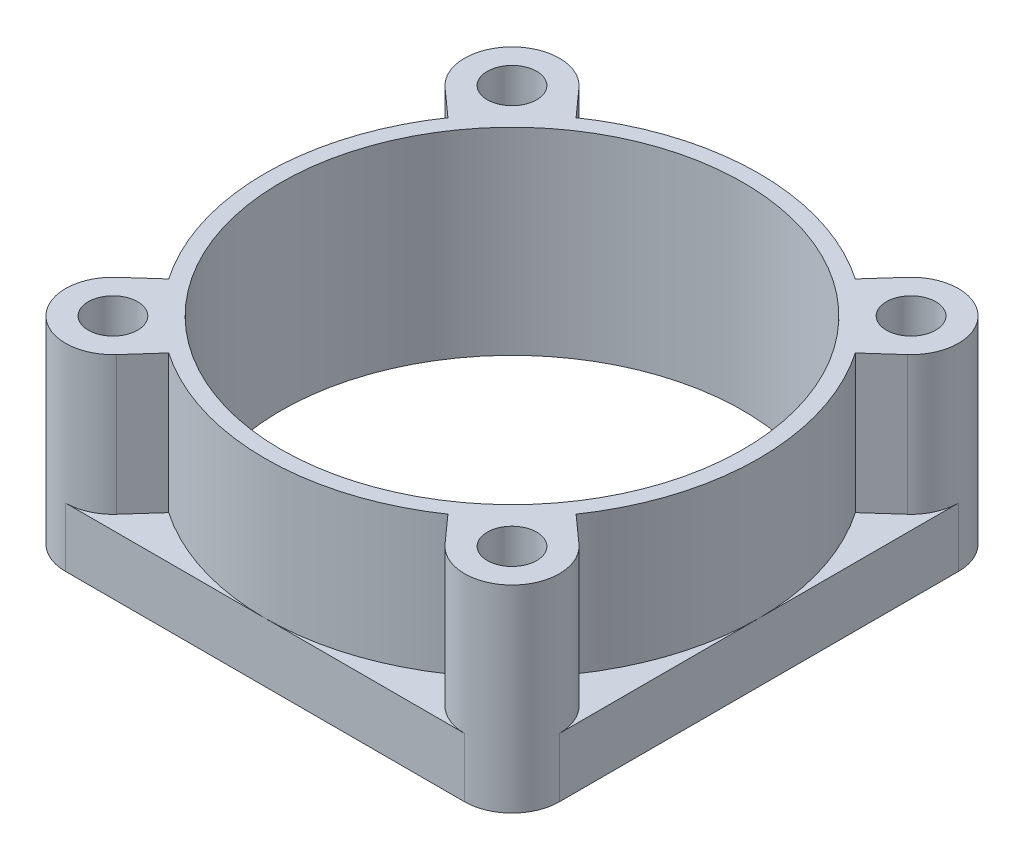
from build123d import *

# Parameters (mm, degrees)
SKETCH_1_R          = 11.7
EXTRUDE_1_DEPTH     = 3
SKETCH_2_R          = 1.25
SKETCH_2_R_2        = 11.7
EXTRUDE_2_DEPTH     = 7
SKETCH_2_3_R        = 1.25
CUT_EXTRUDE_1_DEPTH = 20.013153342


with BuildPart() as part:
    # 草图1 → 凸台-拉伸1 (new body)
    with BuildSketch(Plane(origin=(0, 0, 0), x_dir=(1, 0, 0), z_dir=(0, 1, 0))):
        with BuildLine():
            Line((-10.1, -12.5), (10.1, -12.5))
            ThreePointArc((10.1, -12.5), (11.797056275, -11.797056275), (12.5, -10.1))
            Line((12.5, -10.1), (12.5, 10.1))
            ThreePointArc((12.5, 10.1), (11.797056275, 11.797056275), (10.1, 12.5))
            Line((10.1, 12.5), (-10.1, 12.5))
            ThreePointArc((-10.1, 12.5), (-11.797056275, 11.797056275), (-12.5, 10.1))
            Line((-12.5, 10.1), (-12.5, -10.1))
            ThreePointArc((-12.5, -10.1), (-11.797056275, -11.797056275), (-10.1, -12.5))
        make_face()
        Circle(SKETCH_1_R, mode=Mode.SUBTRACT)
    extrude(amount=EXTRUDE_1_DEPTH)

    # 草图2 → 凸台-拉伸2 (add)
    with BuildSketch(Plane(origin=(0, 3, 0), x_dir=(1, 0, 0), z_dir=(0, 1, 0))):
        with BuildLine():
            ThreePointArc((-12.5, -10.1), (-11.797056275, -11.797056275), (-10.1, -12.5))
            ThreePointArc((-10.1, -12.5), (-9.12067077, -12.29109887), (-8.311827358, -11.700761882))
            Line((-8.311827358, -11.700761882), (-7.067198742, -10.310417156))
            ThreePointArc((-7.067198742, -10.310417156), (-3.699309779, -11.940063114), (-1.8e-08, -12.5))
            ThreePointArc((-1.8e-08, -12.5), (3.699309761, -11.940063119), (7.067198742, -10.310417156))
            Line((7.067198742, -10.310417156), (8.311827358, -11.700761882))
            ThreePointArc((8.311827358, -11.700761882), (9.12067077, -12.29109887), (10.1, -12.5))
            ThreePointArc((10.1, -12.5), (11.797056275, -11.797056275), (12.5, -10.1))
            ThreePointArc((12.5, -10.1), (12.29109887, -9.12067077), (11.700761882, -8.311827358))
            Line((11.700761882, -8.311827358), (10.310417156, -7.067198742))
            ThreePointArc((10.310417156, -7.067198742), (11.940063117, -3.69930977), (12.5, 0))
            ThreePointArc((12.5, 0), (11.940063117, 3.69930977), (10.310417156, 7.067198742))
            Line((10.310417156, 7.067198742), (11.700761882, 8.311827358))
            ThreePointArc((11.700761882, 8.311827358), (12.29109887, 9.12067077), (12.5, 10.1))
            ThreePointArc((12.5, 10.1), (11.797056275, 11.797056275), (10.1, 12.5))
            ThreePointArc((10.1, 12.5), (9.12067077, 12.29109887), (8.311827358, 11.700761882))
            Line((8.311827358, 11.700761882), (7.067198742, 10.310417156))
            ThreePointArc((7.067198742, 10.310417156), (3.699309779, 11.940063114), (1.8e-08, 12.5))
            ThreePointArc((1.8e-08, 12.5), (-3.699309761, 11.940063119), (-7.067198742, 10.310417156))
            Line((-7.067198742, 10.310417156), (-8.311827358, 11.700761882))
            ThreePointArc((-8.311827358, 11.700761882), (-9.12067077, 12.29109887), (-10.1, 12.5))
            ThreePointArc((-10.1, 12.5), (-11.797056275, 11.797056275), (-12.5, 10.1))
            ThreePointArc((-12.5, 10.1), (-12.29109887, 9.12067077), (-11.700761882, 8.311827358))
            Line((-11.700761882, 8.311827358), (-10.310417156, 7.067198742))
            ThreePointArc((-10.310417156, 7.067198742), (-11.940063111, 3.699309787), (-12.5, 3.7e-08))
            ThreePointArc((-12.5, 3.7e-08), (-11.940063122, -3.699309752), (-10.310417156, -7.067198742))
            Line((-10.310417156, -7.067198742), (-11.700761882, -8.311827358))
            ThreePointArc((-11.700761882, -8.311827358), (-12.29109887, -9.12067077), (-12.5, -10.1))
        make_face()
        with Locations((-10.1, -10.1)):
            Circle(SKETCH_2_R, mode=Mode.SUBTRACT)
        with Locations((10.1, -10.1)):
            Circle(SKETCH_2_R, mode=Mode.SUBTRACT)
        Circle(SKETCH_2_R_2, mode=Mode.SUBTRACT)
        with Locations((-10.1, 10.1)):
            Circle(SKETCH_2_R, mode=Mode.SUBTRACT)
        with Locations((10.1, 10.1)):
            Circle(SKETCH_2_R, mode=Mode.SUBTRACT)
    extrude(amount=EXTRUDE_2_DEPTH)

    # 草图2<3> → 切除-拉伸1 (cut, through all)
    with BuildSketch(Plane(origin=(0, 3, 0), x_dir=(1, 0, 0), z_dir=(0, 1, 0))):
        with Locations((-10.1, 10.1)):
            Circle(SKETCH_2_3_R)
        with Locations((10.1, 10.1)):
            Circle(SKETCH_2_3_R)
        with Locations((10.1, -10.1)):
            Circle(SKETCH_2_3_R)
        with Locations((-10.1, -10.1)):
            Circle(SKETCH_2_3_R)
    extrude(amount=-CUT_EXTRUDE_1_DEPTH, mode=Mode.SUBTRACT)


solid = part.part
